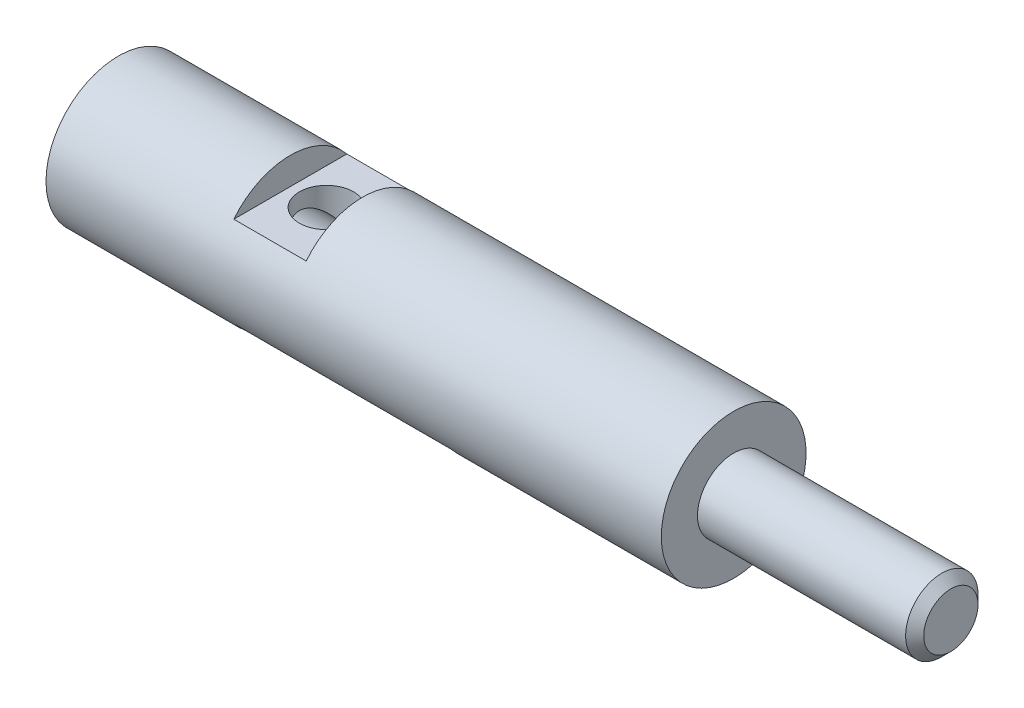
from build123d import *

# Parameters (mm, degrees)
CHAMFER1_SIZE                  = 0.5
F_3_2_3_2_DIAMETER_HOLE1_D     = 3.2
F_3_2_3_2_DIAMETER_HOLE1_DEPTH = 14
F_3_2_3_2_DIAMETER_HOLE1_TIP   = 0.96137699
CUT_EXTRUDE1_DEPTH             = 31.84572737
CUT_EXTRUDE1_DEPTH_BACK        = 31.84572737
SKETCH4_W                      = 12
SKETCH4_H                      = 1.5
SKETCH4_W_2                    = 4
F_3_0_3_DIAMETER_HOLE1_REACH   = 33.268
F_3_0_3_DIAMETER_HOLE1_BORE_R  = 1.5


with BuildPart() as part:
    # Sketch1 → Revolve1 (revolve)
    with BuildSketch(Plane.XY, mode=Mode.PRIVATE) as revolve1_sk:
        Polygon((-15.677419355, 0), (-15.677419355, -4), (18.322580645, -4), (18.322580645, -2), (30.322580645, -2), (30.322580645, 0), align=None)
    revolve(revolve1_sk.sketch.rotate(Axis((-21.419354839, 0, 0), (1, 0, 0)), 270), axis=Axis((-21.419354839, 0, 0), (1, 0, 0)))

    # Chamfer1
    chamfer1_edges = [part.edges().sort_by_distance(p)[0] for p in [
        (30.322580645, 0, -2),
    ]]
    chamfer(chamfer1_edges, length=CHAMFER1_SIZE)

    # Ø3.2 (3.2) Diameter Hole1
    with Locations(Plane.ZY.offset(15.677419355)):
        with Locations((0, 0)):
            Hole(F_3_2_3_2_DIAMETER_HOLE1_D / 2, depth=F_3_2_3_2_DIAMETER_HOLE1_DEPTH)
            with Locations((0, 0, -(F_3_2_3_2_DIAMETER_HOLE1_DEPTH + F_3_2_3_2_DIAMETER_HOLE1_TIP / 2))):  # 118° drill point
                Cone(0, F_3_2_3_2_DIAMETER_HOLE1_D / 2, F_3_2_3_2_DIAMETER_HOLE1_TIP, mode=Mode.SUBTRACT)

    # Sketch4 → Cut-Extrude1 (cut, two sides: drawn at the far end of the back side and taken through both)
    with BuildSketch(Plane.XY.offset(-CUT_EXTRUDE1_DEPTH_BACK)):
        with Locations((-0.177419355, -3.25)):
            Rectangle(SKETCH4_W, SKETCH4_H)
        with Locations((-4.177419355, 3.25)):
            Rectangle(SKETCH4_W_2, SKETCH4_H)
    extrude(amount=CUT_EXTRUDE1_DEPTH + CUT_EXTRUDE1_DEPTH_BACK, mode=Mode.SUBTRACT)

    # Ø3.0 (3) Diameter Hole1 bore → Ø3.0 (3) Diameter Hole1 (cut, up to next)
    with BuildSketch(Plane(origin=(0, 2.5, 0), x_dir=(1, 0, 0), z_dir=(0, 1, 0)), mode=Mode.PRIVATE) as f_3_0_3_diameter_hole1_sk1:
        with Locations((-4.177419355, 0)):
            Circle(F_3_0_3_DIAMETER_HOLE1_BORE_R)
    f_3_0_3_diameter_hole1_tool1 = extrude(f_3_0_3_diameter_hole1_sk1.sketch, amount=-F_3_0_3_DIAMETER_HOLE1_REACH, mode=Mode.PRIVATE) & part.part
    add(f_3_0_3_diameter_hole1_tool1.solids().sort_by_distance((-4.177419, 2.5, 0))[0], mode=Mode.SUBTRACT)


solid = part.part
